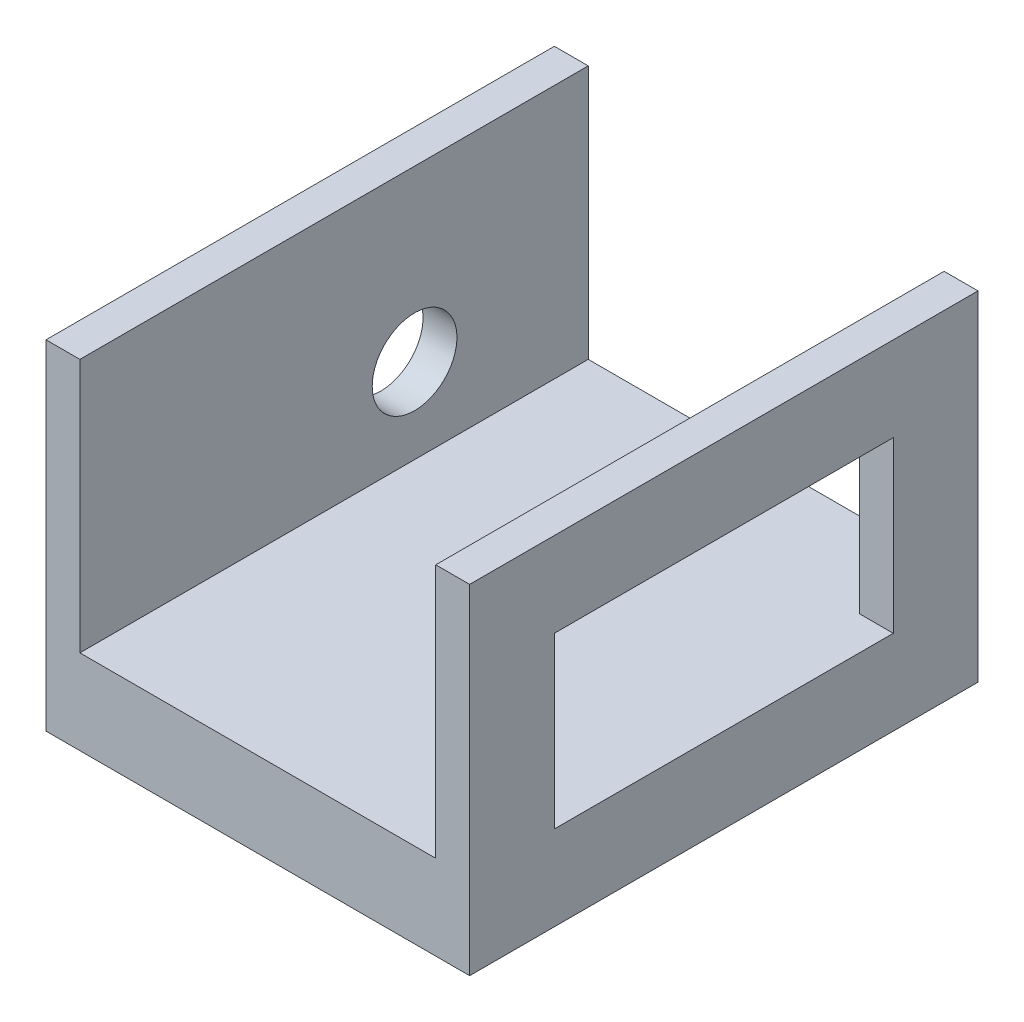
from build123d import *

# Parameters (mm, degrees)
SKETCH4_W           = 50
SKETCH4_H           = 60
BOSS_EXTRUDE6_DEPTH = 40
SKETCH9_W           = 42
SKETCH9_H           = 56.420845642
CUT_EXTRUDE3_DEPTH  = 60
SKETCH10_W          = 40
SKETCH10_H          = 20
CUT_EXTRUDE4_DEPTH  = 20
SKETCH11_R          = 5
CUT_EXTRUDE5_DEPTH  = 10


with BuildPart() as part:
    # Sketch4 → Boss-Extrude6 (new body)
    with BuildSketch(Plane(origin=(0, 0, 0), x_dir=(1, 0, 0), z_dir=(0, 1, 0))):
        Rectangle(SKETCH4_W, SKETCH4_H)
    extrude(amount=BOSS_EXTRUDE6_DEPTH)

    # Sketch9 → Cut-Extrude3 (cut)
    with BuildSketch(Plane.XY.offset(30)):
        with Locations((0, 38.210422821)):
            Rectangle(SKETCH9_W, SKETCH9_H)
    extrude(amount=-CUT_EXTRUDE3_DEPTH, mode=Mode.SUBTRACT)

    # Sketch10 → Cut-Extrude4 (cut)
    with BuildSketch(Plane(origin=(25, 0, 0), x_dir=(0, 0, -1), z_dir=(1, 0, 0))):
        with Locations((0, 20)):
            Rectangle(SKETCH10_W, SKETCH10_H)
    extrude(amount=-CUT_EXTRUDE4_DEPTH, mode=Mode.SUBTRACT)

    # Sketch11 → Cut-Extrude5 (cut)
    with BuildSketch(Plane.ZY.offset(25)):
        with Locations((-9.5, 20)):
            Circle(SKETCH11_R)
    extrude(amount=-CUT_EXTRUDE5_DEPTH, mode=Mode.SUBTRACT)


solid = part.part
